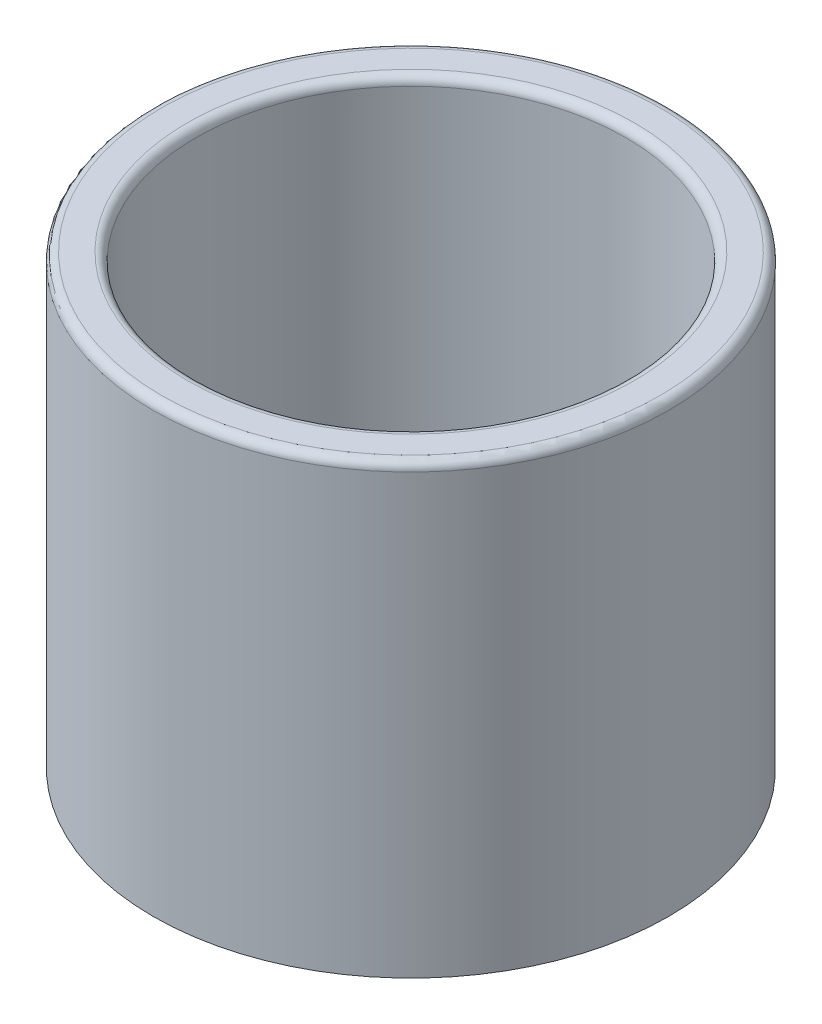
from build123d import *

# Parameters (mm, degrees)
SKETCH1_R           = 30
SKETCH1_R_2         = 25
BOSS_EXTRUDE1_DEPTH = 50
BOSS_EXTRUDE2_START = 2
SKETCH2_R           = 30
BOSS_EXTRUDE2_DEPTH = 2
FILLET1_R           = 1


with BuildPart() as part:
    # Sketch1 → Boss-Extrude1 (new body)
    with BuildSketch(Plane(origin=(0, 0, 0), x_dir=(1, 0, 0), z_dir=(0, 1, 0))):
        with Locations(Location((0, 0, 0), (0, 0, 270))):
            Circle(SKETCH1_R)
        with Locations(Location((0, 0, 0), (0, 0, 270))):
            Circle(SKETCH1_R_2, mode=Mode.SUBTRACT)
    extrude(amount=BOSS_EXTRUDE1_DEPTH)

    # Sketch2 → Boss-Extrude2 (add)
    with BuildSketch(Plane.XZ.offset(BOSS_EXTRUDE2_START)):
        with Locations(Location((0, 0, 0), (0, 0, 270))):
            Circle(SKETCH2_R)
    extrude(amount=-BOSS_EXTRUDE2_DEPTH)

    # Fillet1
    fillet1_edges = [part.edges().sort_by_distance(p)[0] for p in [
        (0, 50, -30),
        (0, 0, -25),
        (0, 50, -25),
    ]]
    fillet(fillet1_edges, radius=FILLET1_R)


solid = part.part
